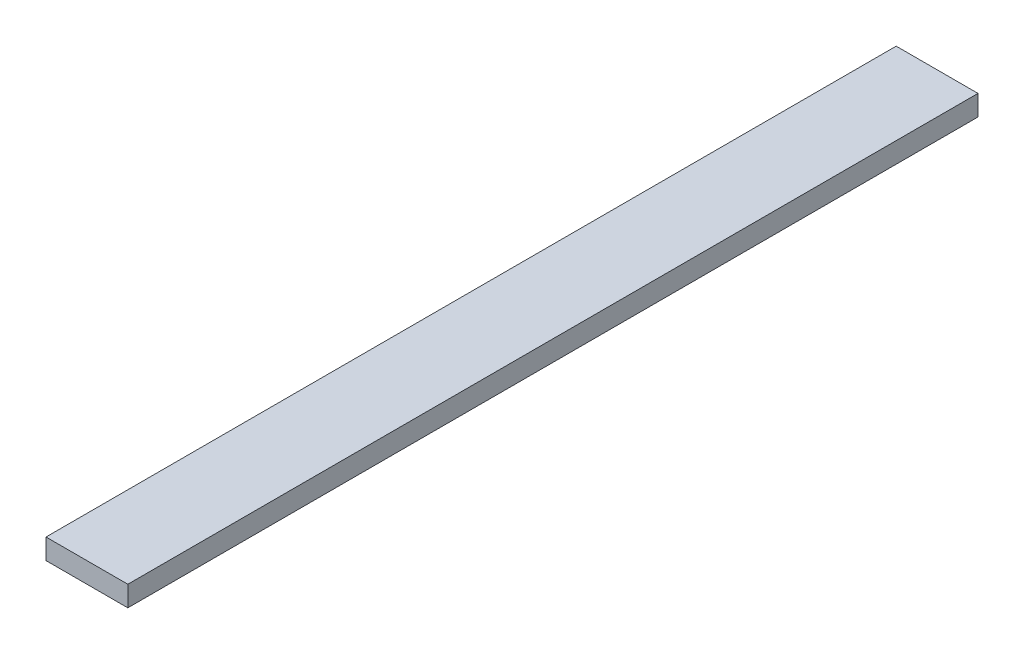
from build123d import *

# Parameters (mm, degrees)
SKETCH1_W           = 152.4
SKETCH1_H           = 1583.5
BOSS_EXTRUDE1_DEPTH = 38.1


with BuildPart() as part:
    # Sketch1 → Boss-Extrude1 (new body)
    with BuildSketch(Plane(origin=(0, 0, 0), x_dir=(1, 0, 0), z_dir=(0, 1, 0))):
        with Locations((76.2, 791.75)):
            Rectangle(SKETCH1_W, SKETCH1_H)
    extrude(amount=BOSS_EXTRUDE1_DEPTH)


solid = part.part
